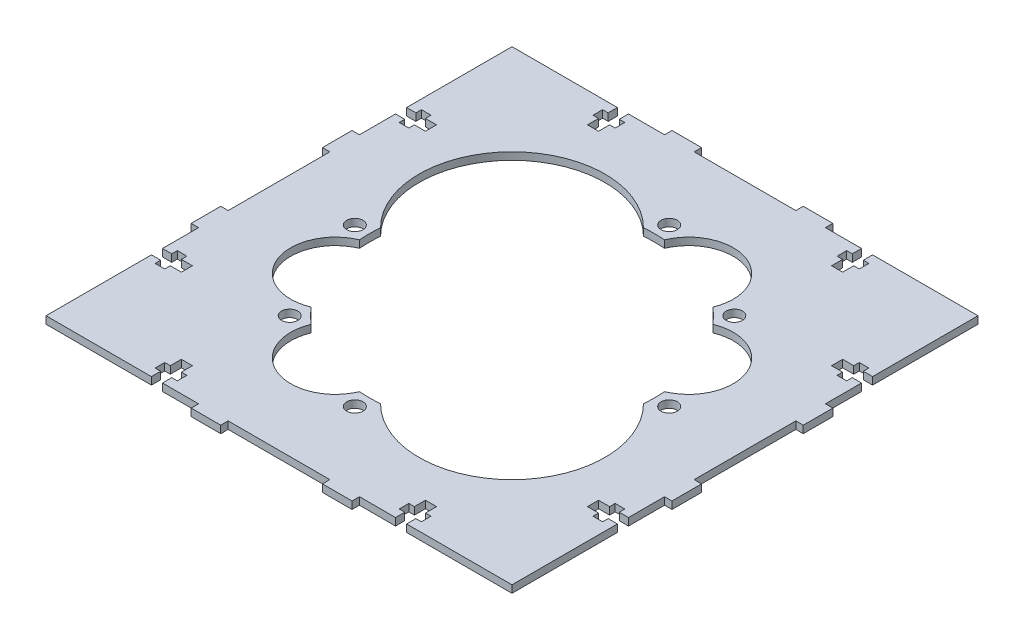
from build123d import *

# Parameters (mm, degrees)
SKETCH_1_R      = 2.2
EXTRUDE_1_DEPTH = 2


with BuildPart() as part:
    # 草图1 → 凸台-拉伸1 (new body)
    with BuildSketch(Plane(origin=(0, 0, 0), x_dir=(1, 0, 0), z_dir=(0, 1, 0))):
        Polygon((159.754738648, 48.995603023), (150.004738648, 48.995603023), (150.004738648, 46.495603023), (151.504738648, 46.495603023), (151.504738648, 43.895603023), (150.004738648, 43.895603023), (150.004738648, 40.895603023), (147.004738648, 40.895603023), (147.004738648, 43.895603023), (145.504738648, 43.895603023), (145.504738648, 46.495603023), (147.004738648, 46.495603023), (147.004738648, 48.995603023), (138.604738648, 48.995603023), (133.504738648, 48.995603023), (118.504738648, 48.995603023), (118.504738648, 33.995603023), (118.504738648, 21.495603023), (118.504738648, 20.495603023), (121.004738648, 20.495603023), (121.004738648, 21.995603023), (123.604738648, 21.995603023), (123.604738648, 20.495603023), (126.604738648, 20.495603023), (126.604738648, 17.495603023), (123.604738648, 17.495603023), (123.604738648, 15.995603023), (121.004738648, 15.995603023), (121.004738648, 17.495603023), (118.504738648, 17.495603023), (118.504738648, 7.745603023), (116.504738648, 7.745603023), (116.504738648, -0.254396977), (118.504738648, -0.254396977), (118.504738648, -27.754396977), (116.504738648, -27.754396977), (116.504738648, -35.754396977), (118.504738648, -35.754396977), (118.504738648, -45.504396977), (121.004738648, -45.504396977), (121.004738648, -44.004396977), (123.604738648, -44.004396977), (123.604738648, -45.504396977), (126.604738648, -45.504396977), (126.604738648, -48.504396977), (123.604738648, -48.504396977), (123.604738648, -50.004396977), (121.004738648, -50.004396977), (121.004738648, -48.504396977), (118.504738648, -48.504396977), (118.504738648, -56.904396977), (118.504738648, -62.004396977), (118.504738648, -77.004396977), (133.504738648, -77.004396977), (146.004738648, -77.004396977), (147.004738648, -77.004396977), (147.004738648, -74.504396977), (145.504738648, -74.504396977), (145.504738648, -71.904396977), (147.004738648, -71.904396977), (147.004738648, -68.904396977), (150.004738648, -68.904396977), (150.004738648, -71.904396977), (151.504738648, -71.904396977), (151.504738648, -74.504396977), (150.004738648, -74.504396977), (150.004738648, -77.004396977), (159.754738648, -77.004396977), (159.754738648, -79.004396977), (167.754738648, -79.004396977), (167.754738648, -77.004396977), (195.254738648, -77.004396977), (195.254738648, -79.004396977), (203.254738648, -79.004396977), (203.254738648, -77.004396977), (213.004738648, -77.004396977), (213.004738648, -74.504396977), (211.504738648, -74.504396977), (211.504738648, -71.904396977), (213.004738648, -71.904396977), (213.004738648, -68.904396977), (216.004738648, -68.904396977), (216.004738648, -71.904396977), (217.504738648, -71.904396977), (217.504738648, -74.504396977), (216.004738648, -74.504396977), (216.004738648, -77.004396977), (224.404738648, -77.004396977), (229.504738648, -77.004396977), (244.504738648, -77.004396977), (244.504738648, -62.004396977), (244.504738648, -49.504396977), (244.504738648, -48.504396977), (242.004738648, -48.504396977), (242.004738648, -50.004396977), (239.404738648, -50.004396977), (239.404738648, -48.504396977), (236.404738648, -48.504396977), (236.404738648, -45.504396977), (239.404738648, -45.504396977), (239.404738648, -44.004396977), (242.004738648, -44.004396977), (242.004738648, -45.504396977), (244.504738648, -45.504396977), (244.504738648, -35.754396977), (246.504738648, -35.754396977), (246.504738648, -27.754396977), (244.504738648, -27.754396977), (244.504738648, -0.254396977), (246.504738648, -0.254396977), (246.504738648, 7.745603023), (244.504738648, 7.745603023), (244.504738648, 17.495603023), (242.004738648, 17.495603023), (242.004738648, 15.995603023), (239.404738648, 15.995603023), (239.404738648, 17.495603023), (236.404738648, 17.495603023), (236.404738648, 20.495603023), (239.404738648, 20.495603023), (239.404738648, 21.995603023), (242.004738648, 21.995603023), (242.004738648, 20.495603023), (244.504738648, 20.495603023), (244.504738648, 28.895603023), (244.504738648, 33.995603023), (244.504738648, 48.995603023), (229.504738648, 48.995603023), (217.004738648, 48.995603023), (216.004738648, 48.995603023), (216.004738648, 46.495603023), (217.504738648, 46.495603023), (217.504738648, 43.895603023), (216.004738648, 43.895603023), (216.004738648, 40.895603023), (213.004738648, 40.895603023), (213.004738648, 43.895603023), (211.504738648, 43.895603023), (211.504738648, 46.495603023), (213.004738648, 46.495603023), (213.004738648, 48.995603023), (203.254738648, 48.995603023), (203.254738648, 50.995603023), (195.254738648, 50.995603023), (195.254738648, 48.995603023), (167.754738648, 48.995603023), (167.754738648, 50.995603023), (159.754738648, 50.995603023), align=None)
        with Locations(Location((181.504738648, -56.504396977, 0), (0, 0, 270))):
            Circle(SKETCH_1_R, mode=Mode.SUBTRACT)
        with Locations(Location((151.452700448, -44.056435178, 0), (0, 0, 270))):
            Circle(SKETCH_1_R, mode=Mode.SUBTRACT)
        with Locations(Location((139.004738648, -14.004396977, 0), (0, 0, 270))):
            Circle(SKETCH_1_R, mode=Mode.SUBTRACT)
        with Locations(Location((224.004738648, -14.004396977, 0), (0, 0, 90))):
            Circle(SKETCH_1_R, mode=Mode.SUBTRACT)
        with Locations(Location((211.556776849, 16.047641223, 0), (0, 0, 270))):
            Circle(SKETCH_1_R, mode=Mode.SUBTRACT)
        with Locations(Location((181.504738648, 28.49819903, 0), (0, 0, 270))):
            Circle(SKETCH_1_R, mode=Mode.SUBTRACT)
        with BuildLine():
            ThreePointArc((156.373636186, -43.170776407), (154.281127573, -41.228008053), (152.338359218, -39.135499439))
            ThreePointArc((152.338359218, -39.135499439), (136.585624733, -32.610503171), (143.110621001, -16.857768685))
            ThreePointArc((143.110621001, -16.857768685), (143.004738648, -14.004396977), (143.110621001, -11.15102527))
            ThreePointArc((143.110621001, -11.15102527), (143.110621001, 24.38972067), (178.65136694, 24.38972067))
            ThreePointArc((178.65136694, 24.38972067), (181.504738648, 24.495603023), (184.358110356, 24.38972067))
            ThreePointArc((184.358110356, 24.38972067), (200.110844842, 30.914716938), (206.63584111, 15.161982452))
            ThreePointArc((206.63584111, 15.161982452), (208.728349724, 13.219214098), (210.671118078, 11.126705484))
            ThreePointArc((210.671118078, 11.126705484), (226.423852564, 4.601709216), (219.898856295, -11.15102527))
            ThreePointArc((219.898856295, -11.15102527), (220.004738648, -14.004396977), (219.898856295, -16.857768685))
            ThreePointArc((219.898856295, -16.857768685), (219.898856295, -52.398514625), (184.358110356, -52.398514625))
            ThreePointArc((184.358110356, -52.398514625), (181.504738648, -52.504396977), (178.65136694, -52.398514625))
            ThreePointArc((178.65136694, -52.398514625), (162.898632455, -58.923510893), (156.373636186, -43.170776407))
        make_face(mode=Mode.SUBTRACT)
    extrude(amount=EXTRUDE_1_DEPTH)


solid = part.part
